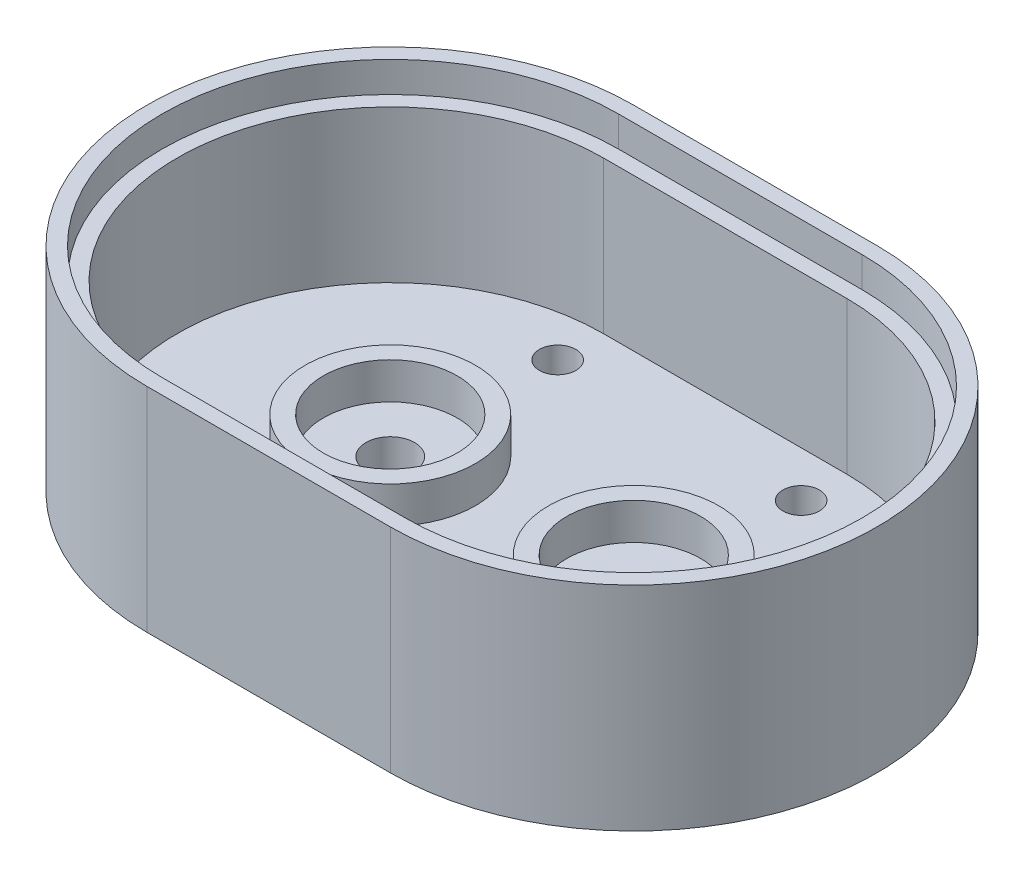
from build123d import *

# Parameters (mm, degrees)
SALIENTE_EXTRUIR1_DEPTH           = 5
SALIENTE_EXTRUIR2_DEPTH           = 30
CORTAR_EXTRUIR1_START             = -5
CORTAR_EXTRUIR1_DEPTH             = 5
CROQUIS7_R                        = 7.5
SALIENTE_EXTRUIR4_DEPTH           = 3
SALIENTE_EXTRUIR4_DRAFT           = 20
SALIENTE_EXTRUIR4_PROFILE_2_DEPTH = 3
SALIENTE_EXTRUIR4_PROFILE_2_DRAFT = 20
CORTAR_EXTRUIR2_REACH             = 80.102
CROQUIS4_R                        = 4
REDONDEO1_R                       = 1
CROQUIS9_R                        = 6.5
SALIENTE_EXTRUIR5_DEPTH           = 3
REDONDEO2_R                       = 1
CORTAR_EXTRUIR3_REACH             = 80.102
CROQUIS8_R                        = 3
CROQUIS10_R                       = 14
CROQUIS10_R_2                     = 11
SALIENTE_EXTRUIR6_DEPTH           = 6


with BuildPart() as part:
    # Croquis1 → Saliente-Extruir1 (new body)
    with BuildSketch(Plane(origin=(0, 0, 0), x_dir=(1, 0, 0), z_dir=(0, 1, 0))):
        with BuildLine():
            Line((-20, 40), (20, 40))
            ThreePointArc((20, 40), (60, 0), (20, -40))
            Line((20, -40), (-20, -40))
            ThreePointArc((-20, -40), (-60, 0), (-20, 40))
        make_face()
    extrude(amount=SALIENTE_EXTRUIR1_DEPTH)

    # Croquis2 → Saliente-Extruir2 (add)
    with BuildSketch(Plane(origin=(0, 5, 0), x_dir=(1, 0, 0), z_dir=(0, 1, 0))):
        with BuildLine():
            Line((-20, -40), (20, -40))
            ThreePointArc((20, -40), (60, 0), (20, 40))
            Line((20, 40), (-20, 40))
            ThreePointArc((-20, 40), (-60, 0), (-20, -40))
        make_face()
        with BuildLine():
            Line((-20, -35), (20, -35))
            ThreePointArc((20, -35), (55, 0), (20, 35))
            Line((20, 35), (-20, 35))
            ThreePointArc((-20, 35), (-55, 0), (-20, -35))
        make_face(mode=Mode.SUBTRACT)
    extrude(amount=SALIENTE_EXTRUIR2_DEPTH)

    # Croquis3 → Cortar-Extruir1 (cut)
    with BuildSketch(Plane(origin=(0, 35, 0), x_dir=(1, 0, 0), z_dir=(0, 1, 0)).offset(CORTAR_EXTRUIR1_START)):
        with BuildLine():
            Line((-20, -37.5), (20, -37.5))
            ThreePointArc((20, -37.5), (57.5, 0), (20, 37.5))
            Line((20, 37.5), (-20, 37.5))
            ThreePointArc((-20, 37.5), (-57.5, 0), (-20, -37.5))
        make_face()
        with BuildLine():
            Line((-20, -35), (20, -35))
            ThreePointArc((20, -35), (55, 0), (20, 35))
            Line((20, 35), (-20, 35))
            ThreePointArc((-20, 35), (-55, 0), (-20, -35))
        make_face(mode=Mode.SUBTRACT)
    extrude(amount=CORTAR_EXTRUIR1_DEPTH, mode=Mode.SUBTRACT)


with BuildPart() as saliente_extruir4_tool:
    # Croquis7 → Saliente-Extruir4 (with draft: the straight prism first)
    with BuildSketch(Plane.XZ):
        with Locations((-20, 0)):
            Circle(CROQUIS7_R)
    extrude(amount=SALIENTE_EXTRUIR4_DEPTH)
    # Saliente-Extruir4: the draft: its side faces are tilted about the plane it starts from
    saliente_extruir4_sides = [saliente_extruir4_tool.faces().sort_by_distance(p)[0] for p in [
        (-27.5, -1.5, 0),
    ]]
    draft(saliente_extruir4_sides, Plane.XZ, SALIENTE_EXTRUIR4_DRAFT)


with BuildPart() as part_1:
    add(part.part)

    # Saliente-Extruir4: add saliente_extruir4_tool
    add(saliente_extruir4_tool.part)


with BuildPart() as saliente_extruir4_profile_2_tool:
    # Croquis7 → Saliente-Extruir4 profile 2 (with draft: the straight prism first)
    with BuildSketch(Plane.XZ):
        with Locations((20, 0)):
            Circle(CROQUIS7_R)
    extrude(amount=SALIENTE_EXTRUIR4_PROFILE_2_DEPTH)
    # Saliente-Extruir4 profile 2: the draft: its side faces are tilted about the plane it starts from
    saliente_extruir4_profile_2_sides = [saliente_extruir4_profile_2_tool.faces().sort_by_distance(p)[0] for p in [
        (12.5, -1.5, 0),
    ]]
    draft(saliente_extruir4_profile_2_sides, Plane.XZ, SALIENTE_EXTRUIR4_PROFILE_2_DRAFT)


with BuildPart() as part_2:
    add(part_1.part)

    # Saliente-Extruir4 profile 2: add saliente_extruir4_profile_2_tool
    add(saliente_extruir4_profile_2_tool.part)

    # Croquis4 → Cortar-Extruir2 (cut, up to next)
    with BuildSketch(Plane(origin=(0, 5, 0), x_dir=(1, 0, 0), z_dir=(0, 1, 0)), mode=Mode.PRIVATE) as cortar_extruir2_sk1:
        with Locations(Location((-20, 0, 0), (0, 0, 270))):
            Circle(CROQUIS4_R)
    cortar_extruir2_tool1 = extrude(cortar_extruir2_sk1.sketch, amount=-CORTAR_EXTRUIR2_REACH, mode=Mode.PRIVATE) & part_2.part
    # Croquis4 → Cortar-Extruir2 (cut, up to next)
    with BuildSketch(Plane(origin=(0, 5, 0), x_dir=(1, 0, 0), z_dir=(0, 1, 0)), mode=Mode.PRIVATE) as cortar_extruir2_sk2:
        with Locations(Location((20, 0, 0), (0, 0, 270))):
            Circle(CROQUIS4_R)
    cortar_extruir2_tool2 = extrude(cortar_extruir2_sk2.sketch, amount=-CORTAR_EXTRUIR2_REACH, mode=Mode.PRIVATE) & part_2.part
    add(cortar_extruir2_tool1.solids().sort_by_distance((-20, 5, 0))[0], mode=Mode.SUBTRACT)
    add(cortar_extruir2_tool2.solids().sort_by_distance((20, 5, 0))[0], mode=Mode.SUBTRACT)

    # Redondeo1
    redondeo1_edges = [part_2.edges().sort_by_distance(p)[0] for p in [
        (-27.5, 0, 0),
        (-26.408089297, -3, 0),
        (12.5, 0, 0),
        (13.591910703, -3, 0),
    ]]
    fillet(redondeo1_edges, radius=REDONDEO1_R)

    # Croquis9 → Saliente-Extruir5 (add)
    with BuildSketch(Plane.XZ):
        with Locations(Location((20, 27.5, 0), (0, 0, 90))):
            Circle(CROQUIS9_R)
        with Locations(Location((-20, 27.5, 0), (0, 0, 90))):
            Circle(CROQUIS9_R)
        with Locations(Location((-20, -27.5, 0), (0, 0, 90))):
            Circle(CROQUIS9_R)
        with Locations(Location((20, -27.5, 0), (0, 0, 90))):
            Circle(CROQUIS9_R)
    extrude(amount=SALIENTE_EXTRUIR5_DEPTH)

    # Redondeo2
    redondeo2_edges = [part_2.edges().sort_by_distance(p)[0] for p in [
        (-20, -3, -34),
        (20, 0, -34),
        (20, -3, -34),
        (20, 0, 21),
        (20, -3, 21),
        (-20, 0, 21),
        (-20, -3, 21),
        (-20, 0, -34),
    ]]
    fillet(redondeo2_edges, radius=REDONDEO2_R)

    # Croquis8 → Cortar-Extruir3 (cut, up to next)
    with BuildSketch(Plane(origin=(0, 5, 0), x_dir=(1, 0, 0), z_dir=(0, 1, 0)), mode=Mode.PRIVATE) as cortar_extruir3_sk1:
        with Locations(Location((-20, 27.5, 0), (0, 0, 270))):
            Circle(CROQUIS8_R)
    cortar_extruir3_tool1 = extrude(cortar_extruir3_sk1.sketch, amount=-CORTAR_EXTRUIR3_REACH, mode=Mode.PRIVATE) & part_2.part
    # Croquis8 → Cortar-Extruir3 (cut, up to next)
    with BuildSketch(Plane(origin=(0, 5, 0), x_dir=(1, 0, 0), z_dir=(0, 1, 0)), mode=Mode.PRIVATE) as cortar_extruir3_sk2:
        with Locations(Location((20, 27.5, 0), (0, 0, 270))):
            Circle(CROQUIS8_R)
    cortar_extruir3_tool2 = extrude(cortar_extruir3_sk2.sketch, amount=-CORTAR_EXTRUIR3_REACH, mode=Mode.PRIVATE) & part_2.part
    # Croquis8 → Cortar-Extruir3 (cut, up to next)
    with BuildSketch(Plane(origin=(0, 5, 0), x_dir=(1, 0, 0), z_dir=(0, 1, 0)), mode=Mode.PRIVATE) as cortar_extruir3_sk3:
        with Locations(Location((20, -27.5, 0), (0, 0, 270))):
            Circle(CROQUIS8_R)
    cortar_extruir3_tool3 = extrude(cortar_extruir3_sk3.sketch, amount=-CORTAR_EXTRUIR3_REACH, mode=Mode.PRIVATE) & part_2.part
    # Croquis8 → Cortar-Extruir3 (cut, up to next)
    with BuildSketch(Plane(origin=(0, 5, 0), x_dir=(1, 0, 0), z_dir=(0, 1, 0)), mode=Mode.PRIVATE) as cortar_extruir3_sk4:
        with Locations(Location((-20, -27.5, 0), (0, 0, 270))):
            Circle(CROQUIS8_R)
    cortar_extruir3_tool4 = extrude(cortar_extruir3_sk4.sketch, amount=-CORTAR_EXTRUIR3_REACH, mode=Mode.PRIVATE) & part_2.part
    add(cortar_extruir3_tool1.solids().sort_by_distance((-20, 5, -27.5))[0], mode=Mode.SUBTRACT)
    add(cortar_extruir3_tool2.solids().sort_by_distance((20, 5, -27.5))[0], mode=Mode.SUBTRACT)
    add(cortar_extruir3_tool3.solids().sort_by_distance((20, 5, 27.5))[0], mode=Mode.SUBTRACT)
    add(cortar_extruir3_tool4.solids().sort_by_distance((-20, 5, 27.5))[0], mode=Mode.SUBTRACT)

    # Croquis10 → Saliente-Extruir6 (add)
    # profile 1 of 2: a face of its own
    with BuildSketch(Plane(origin=(0, 5, 0), x_dir=(1, 0, 0), z_dir=(0, 1, 0))):
        with Locations(Location((-20, 0, 0), (0, 0, 270))):
            Circle(CROQUIS10_R)
        with Locations(Location((-20, 0, 0), (0, 0, 270))):
            Circle(CROQUIS10_R_2, mode=Mode.SUBTRACT)
    # profile 2 of 2: a face of its own
    with BuildSketch(Plane(origin=(0, 5, 0), x_dir=(1, 0, 0), z_dir=(0, 1, 0))):
        with Locations(Location((20, 0, 0), (0, 0, 270))):
            Circle(CROQUIS10_R)
        with Locations(Location((20, 0, 0), (0, 0, 270))):
            Circle(CROQUIS10_R_2, mode=Mode.SUBTRACT)
    extrude(amount=SALIENTE_EXTRUIR6_DEPTH)


solid = part_2.part
